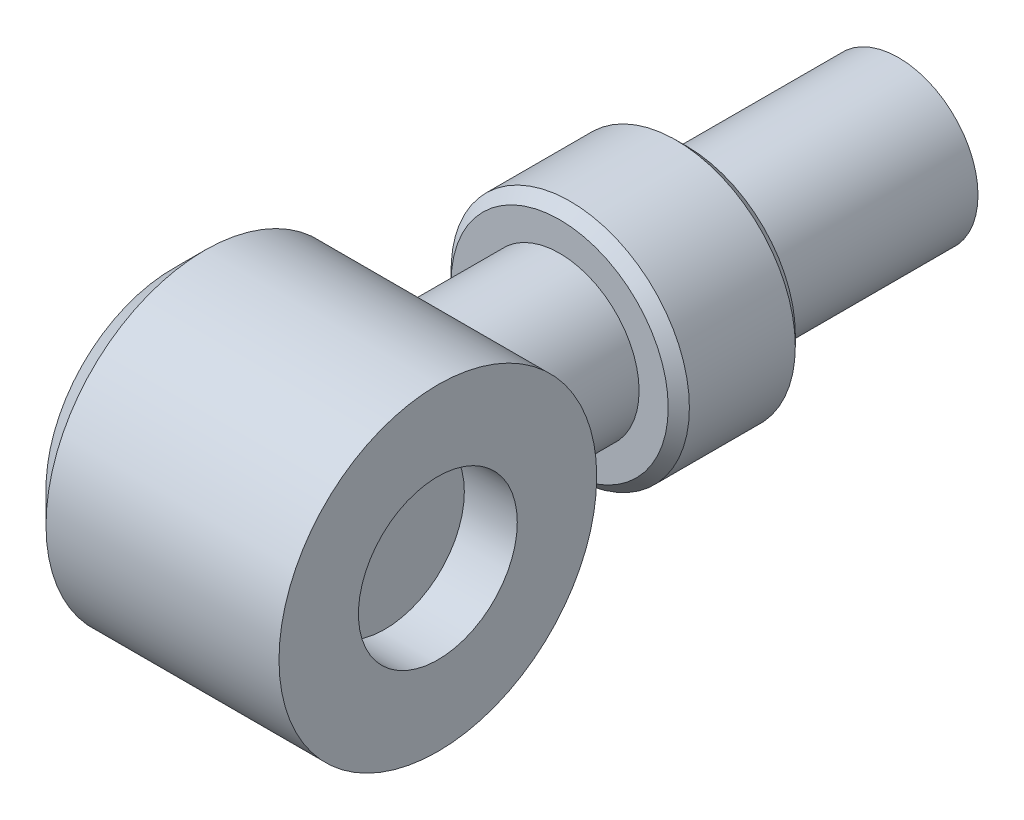
from build123d import *

# Parameters (mm, degrees)
SKETCH1_R                = 22.5
BOSS_EXTRUDE1_DEPTH      = 12
SKETCH2_R                = 15
BOSS_EXTRUDE2_DEPTH      = 40
SKETCH3_R                = 30
BOSS_EXTRUDE3_DEPTH      = 25
BOSS_EXTRUDE4_REACH      = 89.23
BOSS_EXTRUDE4_END_RADIUS = 30
SKETCH4_R                = 15
CHAMFER1_SIZE            = 6
CHAMFER2_SIZE            = 2
SKETCH5_R                = 15
CUT_EXTRUDE1_DEPTH       = 10


with BuildPart() as part:
    # Sketch1 → Boss-Extrude1 (new, symmetric)
    with BuildSketch(Plane.XY):
        Circle(SKETCH1_R)
    extrude(amount=BOSS_EXTRUDE1_DEPTH, both=True)

    # Sketch2 → Boss-Extrude2 (add)
    with BuildSketch(Plane(origin=(0, 0, -12), x_dir=(-1, 0, 0), z_dir=(0, 0, -1))):
        with Locations(Location((0, 0, 0), (0, 0, 180))):
            Circle(SKETCH2_R)
    extrude(amount=BOSS_EXTRUDE2_DEPTH)



with BuildPart() as body_2:
    # Sketch3 → Boss-Extrude3 (new, symmetric)
    with BuildSketch(Plane(origin=(0, 0, 0), x_dir=(0, 0, -1), z_dir=(1, 0, 0))):
        with Locations((-60, 0)):
            Circle(SKETCH3_R)
    extrude(amount=BOSS_EXTRUDE3_DEPTH, both=True)


with BuildPart() as part_1:
    add(part.part)

    add(body_2.part)  # Boss-Extrude4 merges body 2
    # Boss-Extrude4: up to this cylinder (the profile starts outside it)
    boss_extrude4_end = Plane(origin=(0, 0, 60), z_dir=(-1, 0, 0)) * Cylinder(BOSS_EXTRUDE4_END_RADIUS, 239.46, mode=Mode.PRIVATE)
    # Sketch4 → Boss-Extrude4 (add, up to the surface)
    with BuildSketch(Plane.XY.offset(12), mode=Mode.PRIVATE) as boss_extrude4_sk1:
        Circle(SKETCH4_R)
    boss_extrude4_tool1 = extrude(boss_extrude4_sk1.sketch, amount=BOSS_EXTRUDE4_REACH, mode=Mode.PRIVATE) - boss_extrude4_end
    add(boss_extrude4_tool1.solids().sort_by_distance((0, 0, 12))[0])

    # Chamfer1
    chamfer1_edges = [part_1.edges().sort_by_distance(p)[0] for p in [
        (-25, 0, 90),
    ]]
    chamfer(chamfer1_edges, length=CHAMFER1_SIZE)

    # Chamfer2
    chamfer2_edges = [part_1.edges().sort_by_distance(p)[0] for p in [
        (-22.5, 0, -12),
        (-22.5, 0, 12),
    ]]
    chamfer(chamfer2_edges, length=CHAMFER2_SIZE)

    # Sketch5 → Cut-Extrude1 (cut)
    with BuildSketch(Plane(origin=(25, 0, 0), x_dir=(0, 0, -1), z_dir=(1, 0, 0))):
        with Locations((-60, 0)):
            Circle(SKETCH5_R)
    extrude(amount=-CUT_EXTRUDE1_DEPTH, mode=Mode.SUBTRACT)


solid = part_1.part
